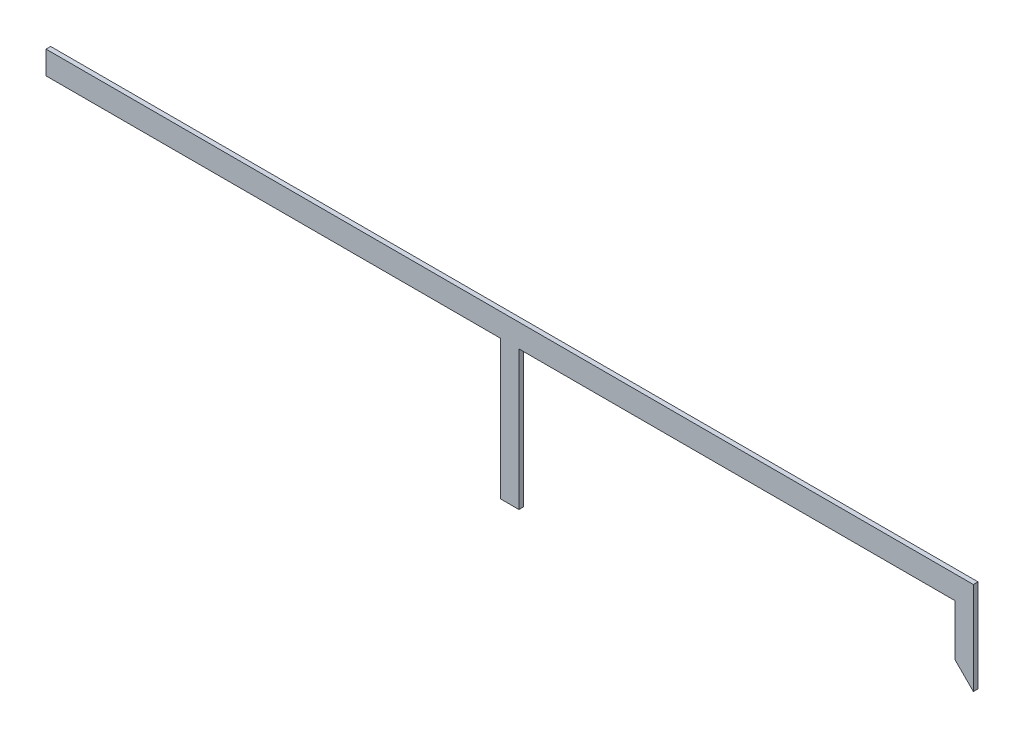
from build123d import *

# Parameters (mm, degrees)
EXTRUDE_1_DEPTH = 5


with BuildPart() as part:
    # 草图1 → 凸台-拉伸1 (new body)
    with BuildSketch(Plane.XY):
        Polygon((-500, 0), (500, 0), (500, -100), (480, -80), (480, -25), (10, -25), (10, -175), (-10, -175), (-10, -25), (-500, -25), align=None)
    extrude(amount=EXTRUDE_1_DEPTH)


solid = part.part
